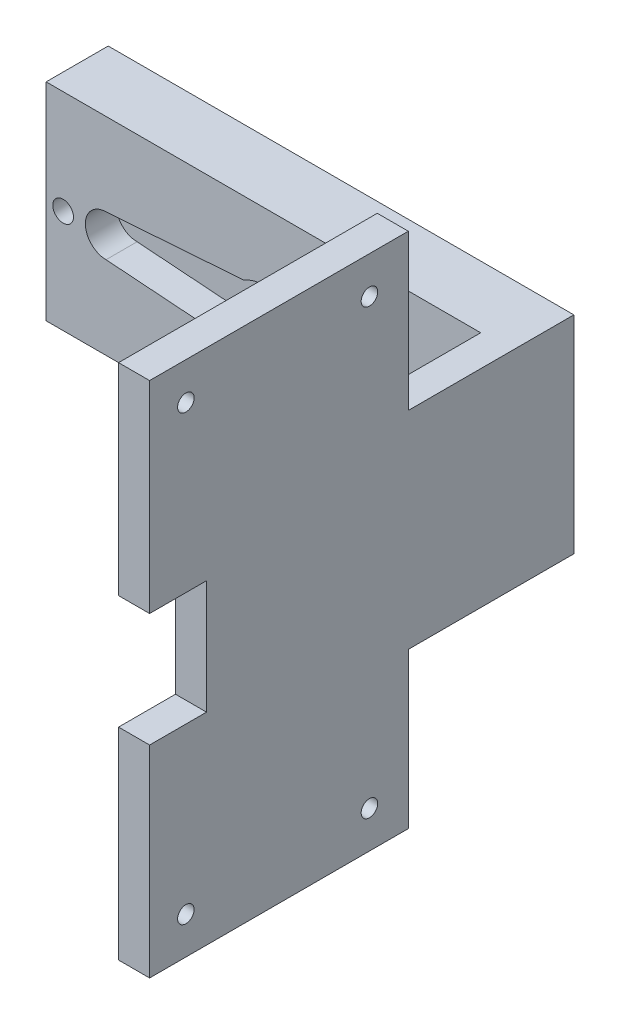
from build123d import *

# Parameters (mm, degrees)
CROQUIS1_W              = 45
CROQUIS1_H              = 20
SALIENTE_EXTRUIR1_DEPTH = 6
CROQUIS2_W              = 3
CROQUIS2_H              = 20
SALIENTE_EXTRUIR2_DEPTH = 10
SALIENTE_EXTRUIR3_DEPTH = 25
CROQUIS4_R              = 0.8
CROQUIS4_W              = 11
CROQUIS4_H              = 11
CORTAR_EXTRUIR1_DEPTH   = 66.810333535
CROQUIS5_R              = 0.998921469
CROQUIS5_R_2            = 1
CORTAR_EXTRUIR2_DEPTH   = 49.541219597
CORTAR_EXTRUIR3_DEPTH   = 3
CROQUIS7_R              = 3.5
CORTAR_EXTRUIR4_DEPTH   = 49.541219597


with BuildPart() as part:
    # Croquis1 → Saliente-Extruir1 (new body)
    with BuildSketch(Plane.XY):
        Rectangle(CROQUIS1_W, CROQUIS1_H)
    extrude(amount=SALIENTE_EXTRUIR1_DEPTH)

    # Croquis2 → Saliente-Extruir2 (add)
    with BuildSketch(Plane.XY.offset(6)):
        with Locations((21, 0)):
            Rectangle(CROQUIS2_W, CROQUIS2_H)
    extrude(amount=SALIENTE_EXTRUIR2_DEPTH)

    # Croquis3 → Saliente-Extruir3 (add)
    with BuildSketch(Plane.XY.offset(16)):
        Polygon((19.5, 0), (19.5, 25), (22.5, 25), (22.5, -25), (19.5, -25), align=None)
    extrude(amount=SALIENTE_EXTRUIR3_DEPTH)

    # Croquis4 → Cortar-Extruir1 (cut, through all)
    with BuildSketch(Plane(origin=(22.5, 0, 0), x_dir=(0, 0, -1), z_dir=(1, 0, 0))):
        with Locations((-19.756259271, -21.41)):
            Circle(CROQUIS4_R)
        with Locations((-37.496259271, -21.41)):
            Circle(CROQUIS4_R)
        with Locations((-19.756259271, 21.41)):
            Circle(CROQUIS4_R)
        with Locations((-37.496259271, 21.41)):
            Circle(CROQUIS4_R)
        with Locations((-41, 0)):
            Rectangle(CROQUIS4_W, CROQUIS4_H)
    extrude(amount=-CORTAR_EXTRUIR1_DEPTH, mode=Mode.SUBTRACT)

    # Croquis5 → Cortar-Extruir2 (cut, through all)
    with BuildSketch(Plane.XY.offset(6)):
        with Locations((-20.857855881, 0)):
            Circle(CROQUIS5_R)
        with Locations((7.642144119, 0)):
            Circle(CROQUIS5_R_2)
    extrude(amount=-CORTAR_EXTRUIR2_DEPTH, mode=Mode.SUBTRACT)

    # Croquis6 → Cortar-Extruir3 (cut)
    with BuildSketch(Plane.XY.offset(6)):
        with BuildLine():
            Line((-16.706350445, 2.011408213), (-3.374218766, 2.960859602))
            Line((-3.374218766, 2.960859602), (0.362949608, 2.958054567))
            Line((0.362949608, 2.958054567), (13.588372541, 1.996246225))
            ThreePointArc((13.588372541, 1.996246225), (15.702474132, -0.012917688), (13.585358857, -2.018905744))
            Line((13.585358857, -2.018905744), (0.358507003, -2.960859602))
            Line((0.358507003, -2.960859602), (-3.37866137, -2.958054567))
            Line((-3.37866137, -2.958054567), (-16.709352754, -1.988590661))
            ThreePointArc((-16.709352754, -1.988590661), (-18.707851036, 0.012909931), (-16.706350445, 2.011408213))
        make_face()
    extrude(amount=-CORTAR_EXTRUIR3_DEPTH, mode=Mode.SUBTRACT)

    # Croquis7 → Cortar-Extruir4 (cut, through all)
    with BuildSketch(Plane.XY.offset(6)):
        with Locations((-1.507855881, 0)):
            Circle(CROQUIS7_R)
    extrude(amount=-CORTAR_EXTRUIR4_DEPTH, mode=Mode.SUBTRACT)


solid = part.part
